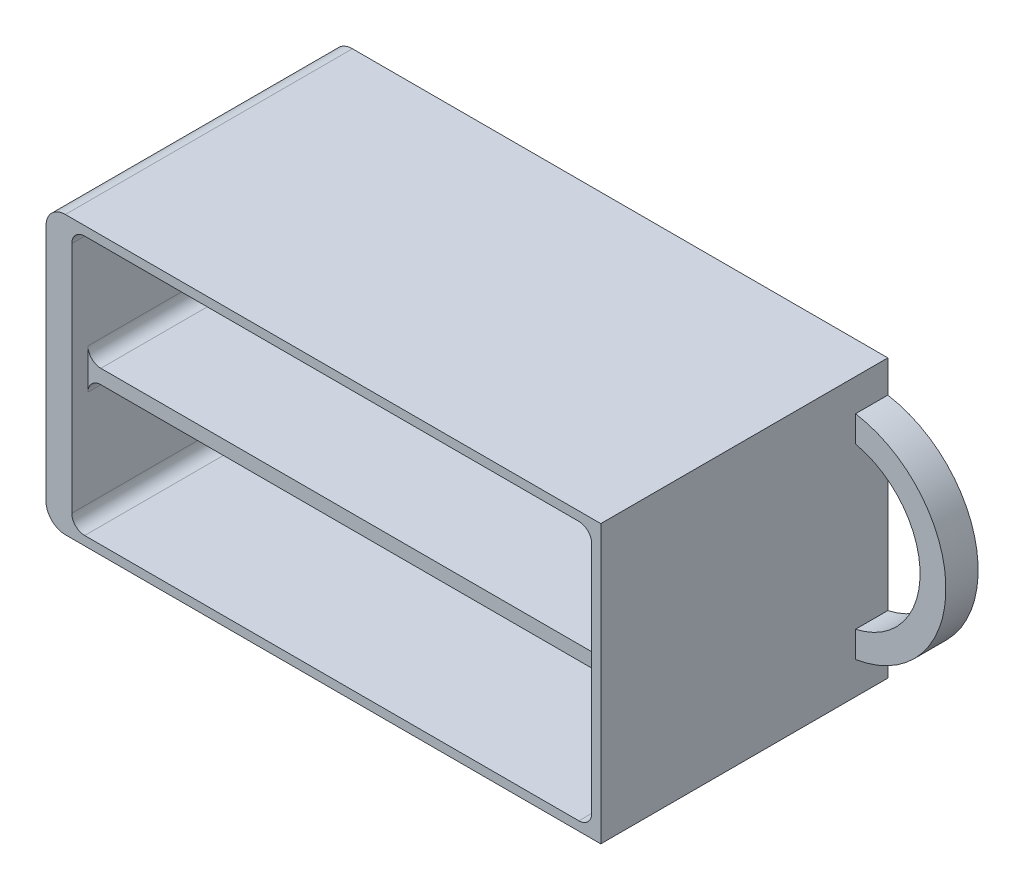
from build123d import *

# Parameters (mm, degrees)
SKETCH_1_W                  = 86
SKETCH_1_H                  = 43
EXTRUDE_1_DEPTH             = 39.5
EXTRUDE_2_DEPTH             = 5
SKETCH_3_W                  = 80.6
SKETCH_3_H                  = 40.2
CUT_EXTRUDE_1_DEPTH         = 43.6
HOLE_WIZARD_8_3_8_3_1_D     = 8.3
HOLE_WIZARD_8_3_8_3_1_DEPTH = 3.2
FILLET_1_R                  = 3
EXTRUDE_START               = -4
SKETCH_6_R                  = 4.15
EXTRUDE_3_DEPTH             = 4
EXTRUDE_4_DEPTH             = 42
FILLET_2_R                  = 2


with BuildPart() as part:
    # Эскиз1 → Бобышка-Вытянуть1 (new body)
    with BuildSketch(Plane.XY.offset(22.25)):
        with Locations((47, 0)):
            Rectangle(SKETCH_1_W, SKETCH_1_H)
    extrude(amount=-EXTRUDE_1_DEPTH)

    # Эскиз2 → Бобышка-Вытянуть2 (add)
    with BuildSketch(Plane(origin=(0, 0, -17.25), x_dir=(-1, 0, 0), z_dir=(0, 0, -1))):
        with BuildLine():
            Line((-90, -21.5), (-90, -16.5))
            ThreePointArc((-90, -16.5), (-104, 0), (-90, 16.5))
            Line((-90, 16.5), (-90, 21.5))
            Line((-90, 21.5), (-4, 21.5))
            Line((-4, 21.5), (-4, -21.5))
            Line((-4, -21.5), (-90, -21.5))
        make_face()
        with BuildLine():
            Line((-90, -12.428366172), (-90, 12.428366172))
            ThreePointArc((-90, 12.428366172), (-100, 0), (-90, -12.428366172))
        make_face(mode=Mode.SUBTRACT)
    extrude(amount=EXTRUDE_2_DEPTH)

    # Эскиз3 → Вырез-Вытянуть1 (cut)
    with BuildSketch(Plane.XY.offset(22.25)):
        with Locations((48.3, 0)):
            Rectangle(SKETCH_3_W, SKETCH_3_H)
    extrude(amount=-CUT_EXTRUDE_1_DEPTH, mode=Mode.SUBTRACT)

    # Диаметр отверстия Ø8.3 (8.3)1
    with Locations(Plane.ZY.offset(-4)):
        with Locations((0, 0)):
            Hole(HOLE_WIZARD_8_3_8_3_1_D / 2, depth=HOLE_WIZARD_8_3_8_3_1_DEPTH)

    # Скругление1
    fillet_1_edges = [part.edges().sort_by_distance(p)[0] for p in [
        (4, -21.5, 0),
        (4, 21.5, 0),
    ]]
    fillet(fillet_1_edges, radius=FILLET_1_R)

    # Эскиз6 → Бобышка-Вытянуть3 (add)
    with BuildSketch(Plane.ZY.offset(-4).offset(EXTRUDE_START)):
        Circle(SKETCH_6_R)
    extrude(amount=EXTRUDE_3_DEPTH)

    # Эскиз7 → Бобышка-Вытянуть4 (add)
    with BuildSketch(Plane(origin=(0, 0, -22.25), x_dir=(-1, 0, 0), z_dir=(0, 0, -1))):
        Polygon((-90, -1.1), (-90, 1.1), (-4, 1.1), (-4, 0), (-4, -1.1), align=None)
    extrude(amount=-EXTRUDE_4_DEPTH)

    # Скругление2
    fillet_2_edges = [part.edges().sort_by_distance(p)[0] for p in [
        (48.3, -20.1, -21.35),
        (88.6, -20.1, 0.45),
        (8, 10.6, -21.35),
        (8, -20.1, 0.45),
        (48.3, 20.1, -21.35),
        (8, 20.1, 0.45),
        (88.6, -10.6, -21.35),
        (88.6, 20.1, 0.45),
        (88.6, 10.6, -21.35),
        (8, -10.6, -21.35),
        (48.3, -1.1, -21.35),
        (48.3, 1.1, -21.35),
        (8, 1.1, -0.8),
        (88.6, 1.1, -0.8),
        (8, -1.1, -0.8),
        (88.6, -1.1, -0.8),
    ]]
    fillet(fillet_2_edges, radius=FILLET_2_R)


solid = part.part
